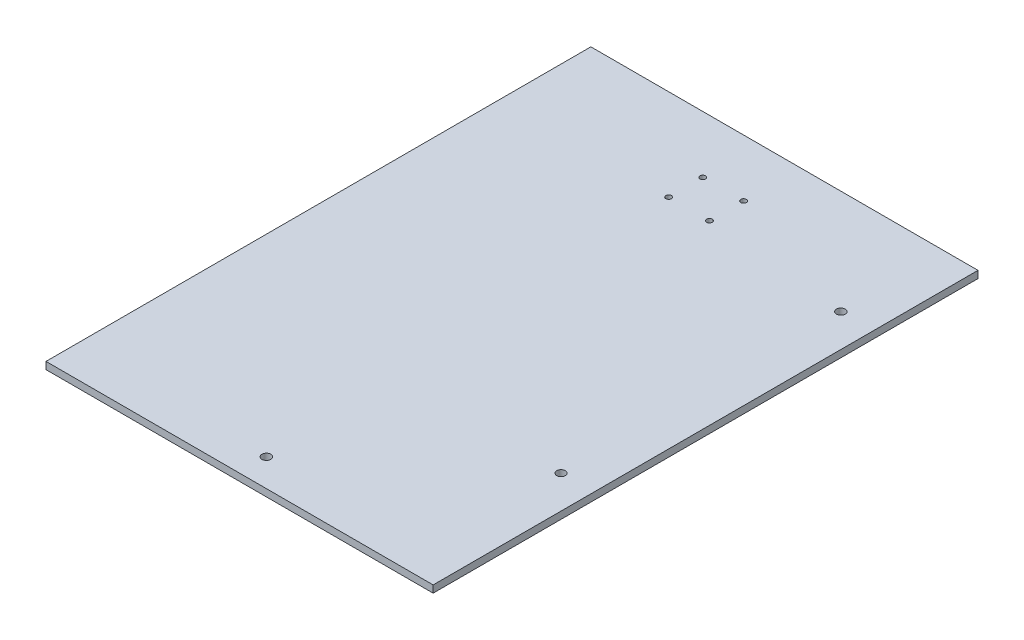
from build123d import *

# Parameters (mm, degrees)
SKETCH1_W           = 270
SKETCH1_H           = 5
BOSS_EXTRUDE1_DEPTH = 380
CUT_EXTRUDE1_REACH  = 471.095
SKETCH6_R           = 1.93305462
SKETCH6_R_2         = 1.937574749
SKETCH6_R_3         = 1.938092279
SKETCH6_R_4         = 1.962476596
CUT_EXTRUDE2_REACH  = 471.095
SKETCH7_R           = 3.018542897
SKETCH7_R_2         = 3.089358341
SKETCH7_R_3         = 3.106196555


with BuildPart() as part:
    # Sketch1 → Boss-Extrude1 (new body)
    with BuildSketch(Plane.XY):
        with Locations((140, 47.5)):
            Rectangle(SKETCH1_W, SKETCH1_H)
    extrude(amount=BOSS_EXTRUDE1_DEPTH)

    # Sketch6 → Cut-Extrude1 (cut, up to next)
    with BuildSketch(Plane.XZ.offset(-45), mode=Mode.PRIVATE) as cut_extrude1_sk1:
        with Locations(Location((122.901099302, 39.846951351, 0), (0, 0, 270))):
            Circle(SKETCH6_R)
    cut_extrude1_tool1 = extrude(cut_extrude1_sk1.sketch, amount=-CUT_EXTRUDE1_REACH, mode=Mode.PRIVATE) & part.part
    # Sketch6 → Cut-Extrude1 (cut, up to next)
    with BuildSketch(Plane.XZ.offset(-45), mode=Mode.PRIVATE) as cut_extrude1_sk2:
        with Locations(Location((122.901099302, 63.66567027, 0), (0, 0, 270))):
            Circle(SKETCH6_R_2)
    cut_extrude1_tool2 = extrude(cut_extrude1_sk2.sketch, amount=-CUT_EXTRUDE1_REACH, mode=Mode.PRIVATE) & part.part
    # Sketch6 → Cut-Extrude1 (cut, up to next)
    with BuildSketch(Plane.XZ.offset(-45), mode=Mode.PRIVATE) as cut_extrude1_sk3:
        with Locations(Location((151.362300698, 39.846951351, 0), (0, 0, 270))):
            Circle(SKETCH6_R_3)
    cut_extrude1_tool3 = extrude(cut_extrude1_sk3.sketch, amount=-CUT_EXTRUDE1_REACH, mode=Mode.PRIVATE) & part.part
    # Sketch6 → Cut-Extrude1 (cut, up to next)
    with BuildSketch(Plane.XZ.offset(-45), mode=Mode.PRIVATE) as cut_extrude1_sk4:
        with Locations(Location((151.362300698, 63.66567027, 0), (0, 0, 270))):
            Circle(SKETCH6_R_4)
    cut_extrude1_tool4 = extrude(cut_extrude1_sk4.sketch, amount=-CUT_EXTRUDE1_REACH, mode=Mode.PRIVATE) & part.part
    add(cut_extrude1_tool1.solids().sort_by_distance((122.901099, 45, 39.846951))[0], mode=Mode.SUBTRACT)
    add(cut_extrude1_tool2.solids().sort_by_distance((122.901099, 45, 63.66567))[0], mode=Mode.SUBTRACT)
    add(cut_extrude1_tool3.solids().sort_by_distance((151.362301, 45, 39.846951))[0], mode=Mode.SUBTRACT)
    add(cut_extrude1_tool4.solids().sort_by_distance((151.362301, 45, 63.66567))[0], mode=Mode.SUBTRACT)

    # Sketch7 → Cut-Extrude2 (cut, up to next)
    with BuildSketch(Plane(origin=(0, 50, 0), x_dir=(1, 0, 0), z_dir=(0, 1, 0)), mode=Mode.PRIVATE) as cut_extrude2_sk1:
        with Locations(Location((252.112318831, -267.889689572, 0), (0, 0, 180))):
            Circle(SKETCH7_R)
    cut_extrude2_tool1 = extrude(cut_extrude2_sk1.sketch, amount=-CUT_EXTRUDE2_REACH, mode=Mode.PRIVATE) & part.part
    # Sketch7 → Cut-Extrude2 (cut, up to next)
    with BuildSketch(Plane(origin=(0, 50, 0), x_dir=(1, 0, 0), z_dir=(0, 1, 0)), mode=Mode.PRIVATE) as cut_extrude2_sk2:
        with Locations(Location((252.112318831, -72.748786013, 0), (0, 0, 180))):
            Circle(SKETCH7_R_2)
    cut_extrude2_tool2 = extrude(cut_extrude2_sk2.sketch, amount=-CUT_EXTRUDE2_REACH, mode=Mode.PRIVATE) & part.part
    # Sketch7 → Cut-Extrude2 (cut, up to next)
    with BuildSketch(Plane(origin=(0, 50, 0), x_dir=(1, 0, 0), z_dir=(0, 1, 0)), mode=Mode.PRIVATE) as cut_extrude2_sk3:
        with Locations(Location((139.467321486, -360.775883093, 0), (0, 0, 180))):
            Circle(SKETCH7_R_3)
    cut_extrude2_tool3 = extrude(cut_extrude2_sk3.sketch, amount=-CUT_EXTRUDE2_REACH, mode=Mode.PRIVATE) & part.part
    add(cut_extrude2_tool1.solids().sort_by_distance((252.112319, 50, 267.88969))[0], mode=Mode.SUBTRACT)
    add(cut_extrude2_tool2.solids().sort_by_distance((252.112319, 50, 72.748786))[0], mode=Mode.SUBTRACT)
    add(cut_extrude2_tool3.solids().sort_by_distance((139.467321, 50, 360.775883))[0], mode=Mode.SUBTRACT)


solid = part.part
